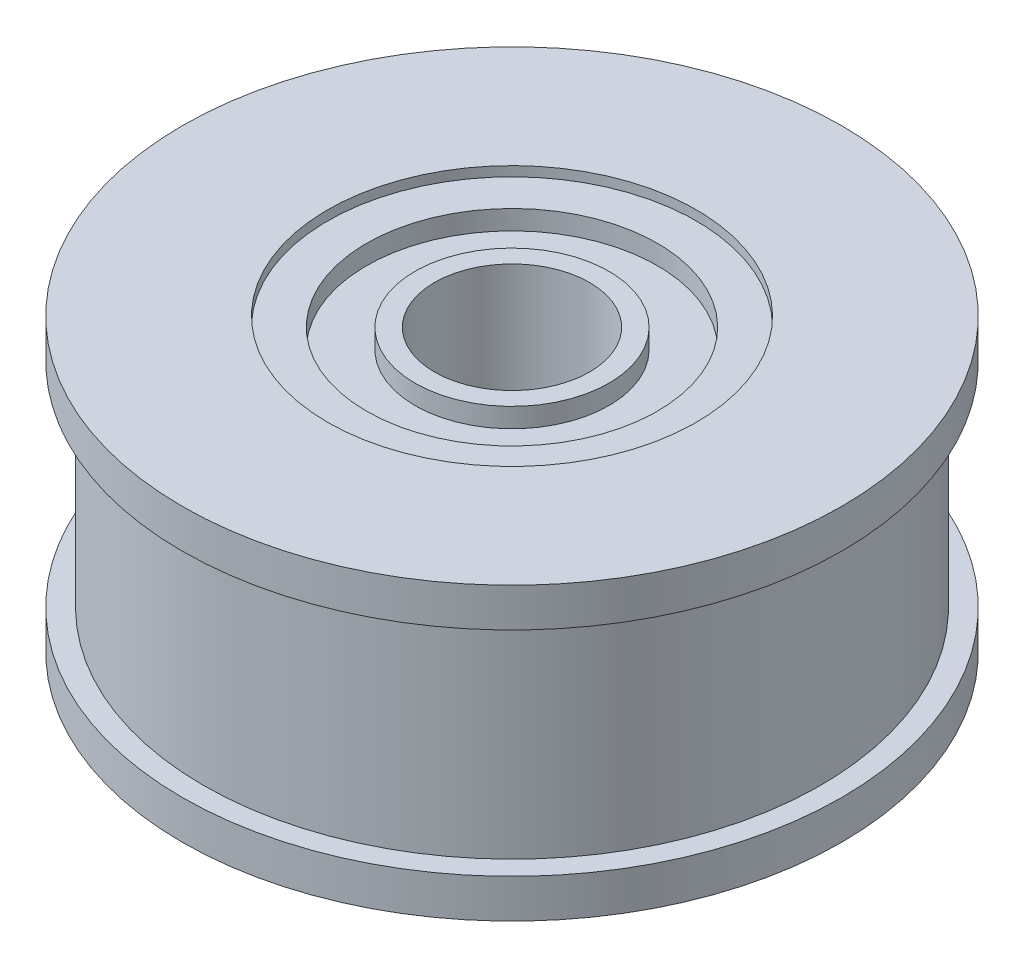
from build123d import *

# Parameters (mm, degrees)
SKETCH_1_R          = 15.915
EXTRUDE_1_DEPTH     = 11
SKETCH_2_R          = 17
EXTRUDE_2_DEPTH     = 2
EXTRUDE_START       = 2
SKETCH_3_R          = 17
EXTRUDE_3_DEPTH     = 2
SKETCH_4_R          = 9.5
SKETCH_4_R_2        = 7.5
CUT_EXTRUDE_1_DEPTH = 0.5
SKETCH_4_3_R        = 7.5
SKETCH_4_3_R_2      = 5
CUT_EXTRUDE_2_DEPTH = 1.5
SKETCH_4_4_R        = 5
SKETCH_4_4_R_2      = 4
CUT_EXTRUDE_3_DEPTH = 0.5
SKETCH_4_5_R        = 4
CUT_EXTRUDE_4_DEPTH = 29.337254631
CUT_EXTRUDE_START   = -0.5
SKETCH_6_R          = 9.5
SKETCH_6_R_2        = 7.5
CUT_EXTRUDE_5_DEPTH = 0.5
CUT_EXTRUDE_START_2 = -1.5
SKETCH_6_3_R        = 7.5
SKETCH_6_3_R_2      = 5
CUT_EXTRUDE_6_DEPTH = 1.5
SKETCH_6_5_R        = 5
SKETCH_6_5_R_2      = 4
CUT_EXTRUDE_7_DEPTH = 0.5


with BuildPart() as part:
    # 草图1 → 凸台-拉伸1 (new body)
    with BuildSketch(Plane(origin=(0, 0, 0), x_dir=(1, 0, 0), z_dir=(0, 1, 0))):
        Circle(SKETCH_1_R)
    extrude(amount=EXTRUDE_1_DEPTH)

    # 草图2 → 凸台-拉伸2 (add)
    with BuildSketch(Plane(origin=(0, 11, 0), x_dir=(1, 0, 0), z_dir=(0, 1, 0))):
        Circle(SKETCH_2_R)
    extrude(amount=EXTRUDE_2_DEPTH)

    # 草图3 → 凸台-拉伸3 (add)
    with BuildSketch(Plane.XZ.offset(EXTRUDE_START)):
        Circle(SKETCH_3_R)
    extrude(amount=-EXTRUDE_3_DEPTH)

    # 草图4 → 切除-拉伸1 (cut)
    with BuildSketch(Plane.XZ.offset(2)):
        Circle(SKETCH_4_R)
        Circle(SKETCH_4_R_2, mode=Mode.SUBTRACT)
    extrude(amount=-CUT_EXTRUDE_1_DEPTH, mode=Mode.SUBTRACT)

    # 草图4<3> → 切除-拉伸2 (cut)
    with BuildSketch(Plane.XZ.offset(2)):
        Circle(SKETCH_4_3_R)
        Circle(SKETCH_4_3_R_2, mode=Mode.SUBTRACT)
    extrude(amount=-CUT_EXTRUDE_2_DEPTH, mode=Mode.SUBTRACT)

    # 草图4<4> → 切除-拉伸3 (cut)
    with BuildSketch(Plane.XZ.offset(2)):
        Circle(SKETCH_4_4_R)
        Circle(SKETCH_4_4_R_2, mode=Mode.SUBTRACT)
    extrude(amount=-CUT_EXTRUDE_3_DEPTH, mode=Mode.SUBTRACT)

    # 草图4<5> → 切除-拉伸4 (cut, through all)
    with BuildSketch(Plane.XZ.offset(2)):
        Circle(SKETCH_4_5_R)
    extrude(amount=-CUT_EXTRUDE_4_DEPTH, mode=Mode.SUBTRACT)

    # 草图6 → 切除-拉伸5 (cut)
    with BuildSketch(Plane(origin=(0, 13, 0), x_dir=(1, 0, 0), z_dir=(0, 1, 0)).offset(CUT_EXTRUDE_START)):
        Circle(SKETCH_6_R)
        Circle(SKETCH_6_R_2, mode=Mode.SUBTRACT)
    extrude(amount=CUT_EXTRUDE_5_DEPTH, mode=Mode.SUBTRACT)

    # 草图6<3> → 切除-拉伸6 (cut)
    with BuildSketch(Plane(origin=(0, 13, 0), x_dir=(1, 0, 0), z_dir=(0, 1, 0)).offset(CUT_EXTRUDE_START_2)):
        Circle(SKETCH_6_3_R)
        Circle(SKETCH_6_3_R_2, mode=Mode.SUBTRACT)
    extrude(amount=CUT_EXTRUDE_6_DEPTH, mode=Mode.SUBTRACT)

    # 草图6<5> → 切除-拉伸7 (cut)
    with BuildSketch(Plane(origin=(0, 13, 0), x_dir=(1, 0, 0), z_dir=(0, 1, 0)).offset(CUT_EXTRUDE_START)):
        Circle(SKETCH_6_5_R)
        Circle(SKETCH_6_5_R_2, mode=Mode.SUBTRACT)
    extrude(amount=CUT_EXTRUDE_7_DEPTH, mode=Mode.SUBTRACT)


solid = part.part
